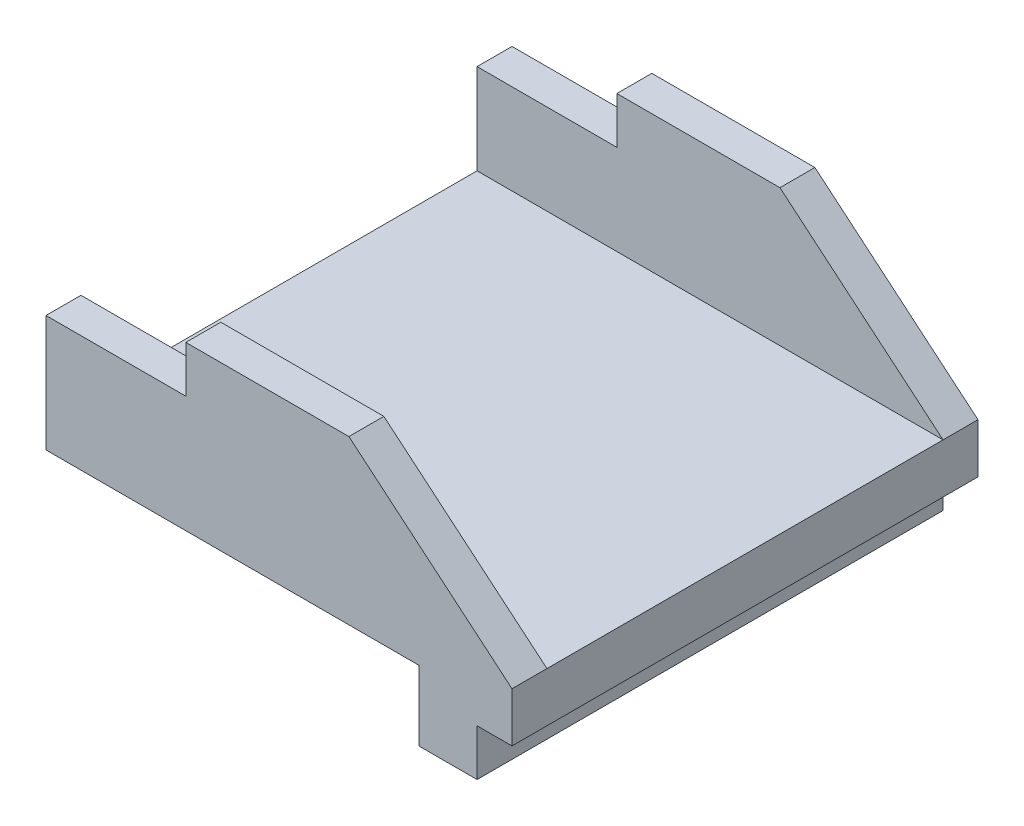
from build123d import *

# Parameters (mm, degrees)
SKETCH_1_W               = 20
SKETCH_1_H               = 10
EXTRUDE_2_DEPTH          = 10
SKETCH_2_W               = 6
SKETCH_2_H               = 2
SKETCH_2_W_2             = 16
SKETCH_2_H_2             = 3
SKETCH_2_W_3             = 1.5
CUT_EXTRUDE_1_DEPTH      = 23.912878475
CUT_EXTRUDE_2_DEPTH      = 20
CUT_EXTRUDE_2_DEPTH_BACK = 20
SKETCH_7_W               = 17
SKETCH_7_H               = 5.873697418


with BuildPart() as part:
    # Эскиз1 → Бобышка-Вытянуть2 (new, symmetric)
    with BuildSketch(Plane.XY):
        Rectangle(SKETCH_1_W, SKETCH_1_H)
    extrude(amount=EXTRUDE_2_DEPTH, both=True)

    # Эскиз2 → Вырез-Вытянуть1 (cut, through all)
    with BuildSketch(Plane.XY.offset(10)):
        with Locations((-7, 4)):
            Rectangle(SKETCH_2_W, SKETCH_2_H)
        Polygon((10, 5), (3, 5), (10, -0.873697418), align=None)
        with Locations((-2, -3.5)):
            Rectangle(SKETCH_2_W_2, SKETCH_2_H_2)
        with Locations((9.25, -4)):
            Rectangle(SKETCH_2_W_3, SKETCH_2_H)
    extrude(amount=-CUT_EXTRUDE_1_DEPTH, mode=Mode.SUBTRACT)

    # Эскиз7 → Вырез-Вытянуть2 (cut, two sides: drawn at the far end of the back side and taken through both)
    with BuildSketch(Plane(origin=(0, 0, 0), x_dir=(0, 0, -1), z_dir=(1, 0, 0)).offset(-CUT_EXTRUDE_2_DEPTH_BACK)):
        with Locations((0, 2.063151291)):
            Rectangle(SKETCH_7_W, SKETCH_7_H)
    extrude(amount=CUT_EXTRUDE_2_DEPTH + CUT_EXTRUDE_2_DEPTH_BACK, mode=Mode.SUBTRACT)


solid = part.part
